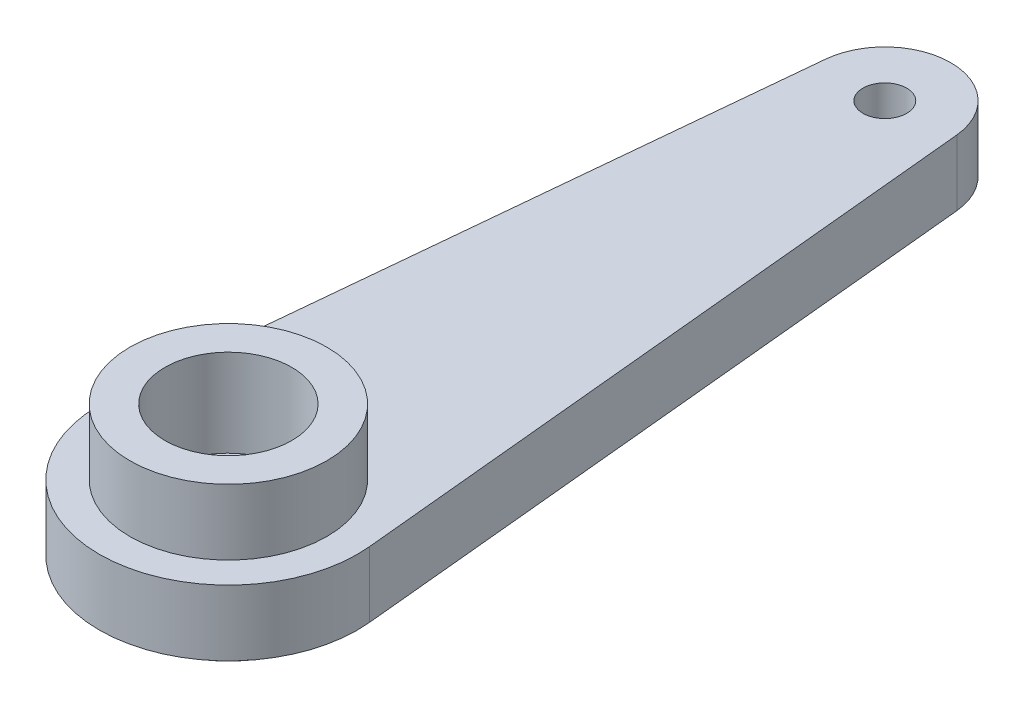
from build123d import *

# Parameters (mm, degrees)
SKETCH2_R           = 2.9
SKETCH2_R_2         = 1
BOSS_EXTRUDE1_DEPTH = 3
SKETCH2_4_R         = 2.9
SKETCH2_4_R_2       = 1.25
BOSS_EXTRUDE2_DEPTH = 2
SKETCH7_R           = 4.5
SKETCH7_R_2         = 2.9
BOSS_EXTRUDE3_DEPTH = 3
BOSS_EXTRUDE4_START = 1
SKETCH8_R           = 4.5
SKETCH8_R_2         = 2.875
BOSS_EXTRUDE4_DEPTH = 1
SKETCH9_R           = 2.875
CUT_EXTRUDE2_DEPTH  = 0.5


with BuildPart() as part:
    # Sketch2 → Boss-Extrude1 (new body)
    with BuildSketch(Plane(origin=(0, 0, 0), x_dir=(1, 0, 0), z_dir=(0, 1, 0))):
        with BuildLine():
            ThreePointArc((3, 30.28994689), (0, 33.013978965), (-3, 30.28994689))
            Line((-3, 30.28994689), (-5.872635545, 0.567584137))
            ThreePointArc((-5.872635545, 0.567584137), (0, -5.9), (5.872635545, 0.567584137))
            Line((5.872635545, 0.567584137), (3, 30.28994689))
        make_face()
        Circle(SKETCH2_R, mode=Mode.SUBTRACT)
        with Locations((0, 30)):
            Circle(SKETCH2_R_2, mode=Mode.SUBTRACT)
    extrude(amount=BOSS_EXTRUDE1_DEPTH)

    # Sketch2<4> → Boss-Extrude2 (add)
    with BuildSketch(Plane(origin=(0, 0, 0), x_dir=(1, 0, 0), z_dir=(0, 1, 0))):
        Circle(SKETCH2_4_R)
        Circle(SKETCH2_4_R_2, mode=Mode.SUBTRACT)
    extrude(amount=BOSS_EXTRUDE2_DEPTH)

    # Sketch7 → Boss-Extrude3 (add)
    with BuildSketch(Plane(origin=(0, 3, 0), x_dir=(1, 0, 0), z_dir=(0, 1, 0))):
        Circle(SKETCH7_R)
        Circle(SKETCH7_R_2, mode=Mode.SUBTRACT)
    extrude(amount=BOSS_EXTRUDE3_DEPTH)

    # Sketch8 → Boss-Extrude4 (add)
    with BuildSketch(Plane.XZ.offset(BOSS_EXTRUDE4_START)):
        Circle(SKETCH8_R)
        Circle(SKETCH8_R_2, mode=Mode.SUBTRACT)
    extrude(amount=-BOSS_EXTRUDE4_DEPTH)

    # Sketch9 → Cut-Extrude2 (cut)
    with BuildSketch(Plane.XZ):
        Circle(SKETCH9_R)
    extrude(amount=-CUT_EXTRUDE2_DEPTH, mode=Mode.SUBTRACT)


solid = part.part
